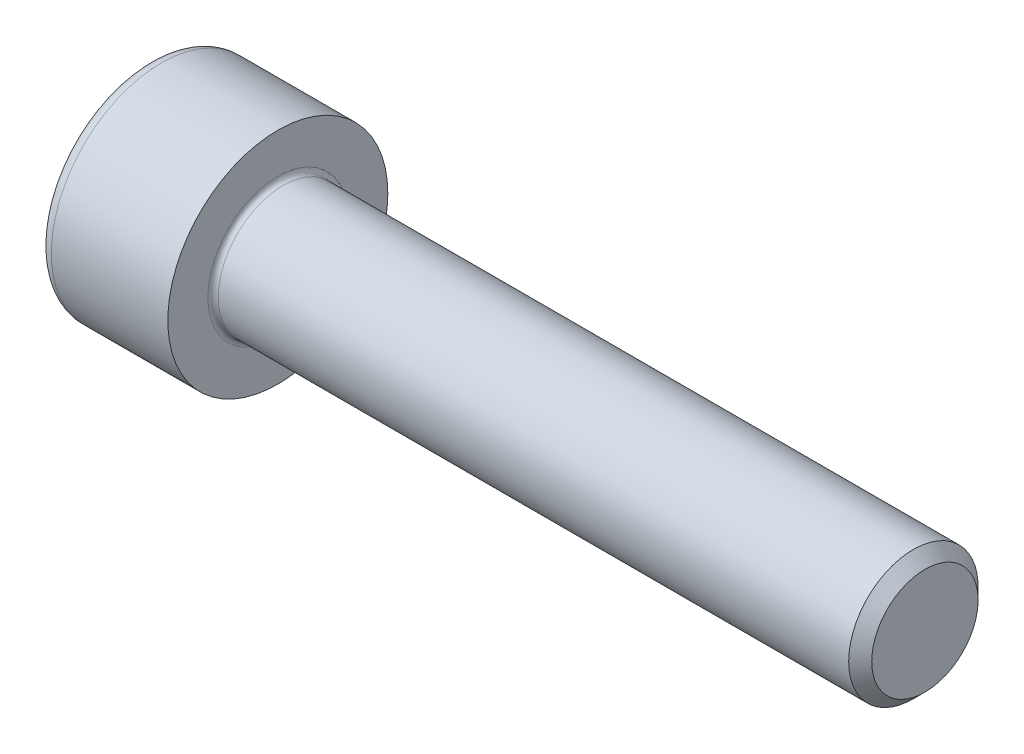
from build123d import *

# Parameters (mm, degrees)
BASEHEADSKE_R   = 4.25
BASEHEAD_DEPTH  = 5
CUTSOCKET_DEPTH = 2.5
FILLET1_R       = 0.2
FILLET2_R       = 0.5


with BuildPart() as part:
    # BaseHeadSke → BaseHead (new body)
    with BuildSketch(Plane(origin=(0, 0, 0), x_dir=(0, 0, -1), z_dir=(1, 0, 0))):
        Circle(BASEHEADSKE_R)
    extrude(amount=BASEHEAD_DEPTH)

    # BodySke → BaseBody (revolve)
    with BuildSketch(Plane.XY, mode=Mode.PRIVATE) as basebody_sk:
        Polygon((0, 0), (30, 0), (30, 2.055), (29.555, 2.5), (0, 2.5), align=None)
    revolve(basebody_sk.sketch.rotate(Axis((0, 0, 0), (1, 0, 0)), 90), axis=Axis((0, 0, 0), (1, 0, 0)))

    # CutSocketSke → CutSocket (cut)
    with BuildSketch(Plane(origin=(0, 0, 0), x_dir=(0, 0, -1), z_dir=(1, 0, 0))):
        Polygon((0, 2.309401077), (-2, 1.154700538), (-2, -1.154700538), (0, -2.309401077), (2, -1.154700538), (2, 1.154700538), align=None)
    extrude(amount=CUTSOCKET_DEPTH, mode=Mode.SUBTRACT)

    # CutHoleSke → CutHole (revolve, cut)
    with BuildSketch(Plane.XY, mode=Mode.PRIVATE) as cuthole_sk:
        Polygon((0, 2), (3.1, 2), (4.254700538, 0), (0, 0), align=None)
    revolve(cuthole_sk.sketch.rotate(Axis((0, 0, 0), (1, 0, 0)), 90), axis=Axis((0, 0, 0), (1, 0, 0)), mode=Mode.SUBTRACT)

    # Fillet1
    fillet1_edges = [part.edges().sort_by_distance(p)[0] for p in [
        (5, 0, -2.5),
    ]]
    fillet(fillet1_edges, radius=FILLET1_R)

    # Fillet2
    fillet2_edges = [part.edges().sort_by_distance(p)[0] for p in [
        (0, 0, 4.25),
    ]]
    fillet(fillet2_edges, radius=FILLET2_R)


solid = part.part
